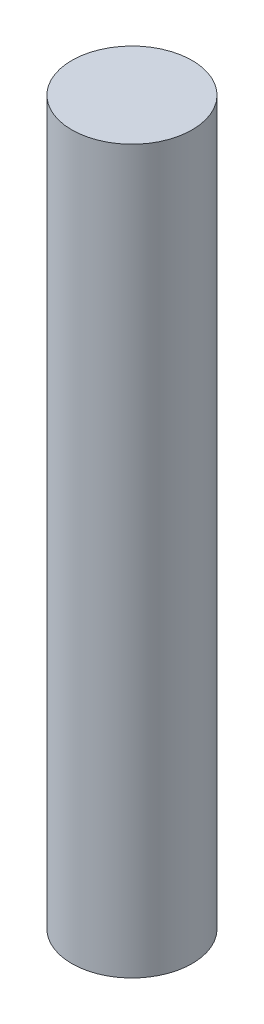
from build123d import *

# Parameters (mm, degrees)
TORQUE_PIN_ENVELOPE_SKETCH_R = 1
TORQUE_PIN_ENVELOPE_DEPTH    = 12


with BuildPart() as part:
    # Torque pin envelope sketch → Torque pin envelope (new body)
    with BuildSketch(Plane(origin=(0, -35, 0), x_dir=(1, 0, 0), z_dir=(0, 1, 0))):
        with Locations(Location((-2, 19.5, 0), (0, 0, 270))):
            Circle(TORQUE_PIN_ENVELOPE_SKETCH_R)
    extrude(amount=TORQUE_PIN_ENVELOPE_DEPTH)


solid = part.part
